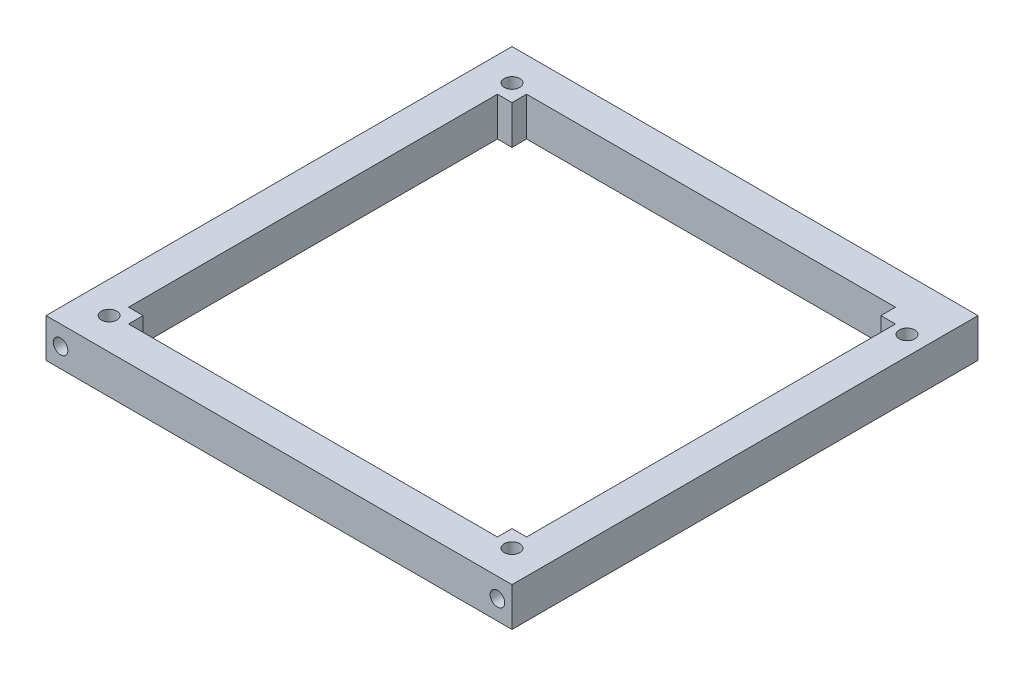
from build123d import *

# Parameters (mm, degrees)
SKETCH1_W                    = 96
SKETCH1_H                    = 96
SKETCH1_W_2                  = 80
SKETCH1_H_2                  = 80
BOSS_EXTRUDE1_DEPTH          = 8
F_3_0_3_DIAMETER_HOLE6_D     = 3
F_3_0_3_DIAMETER_HOLE6_DEPTH = 6
F_3_0_3_DIAMETER_HOLE3_D     = 3
F_3_0_3_DIAMETER_HOLE3_DEPTH = 6
SKETCH27_W                   = 82
SKETCH27_H                   = 82
CUT_EXTRUDE2_DEPTH           = 10
SKETCH35_W                   = 3
SKETCH35_H                   = 3
BOSS_EXTRUDE2_DEPTH          = 8
F_3_2_3_2_DIAMETER_HOLE1_D   = 3.2


with BuildPart() as part:
    # Sketch1 → Boss-Extrude1 (new body)
    with BuildSketch(Plane(origin=(0, 0, 0), x_dir=(1, 0, 0), z_dir=(0, 1, 0))):
        Rectangle(SKETCH1_W, SKETCH1_H)
        Rectangle(SKETCH1_W_2, SKETCH1_H_2, mode=Mode.SUBTRACT)
    extrude(amount=BOSS_EXTRUDE1_DEPTH)

    # Ø3.0 (3) Diameter Hole6
    with Locations(Plane.XY.offset(48)):
        with Locations((45, 4), (-45, 4)):
            Hole(F_3_0_3_DIAMETER_HOLE6_D / 2, depth=F_3_0_3_DIAMETER_HOLE6_DEPTH)

    # Ø3.0 (3) Diameter Hole3
    with Locations(Plane(origin=(0, 0, -48), x_dir=(-1, 0, 0), z_dir=(0, 0, -1))):
        with Locations((45, 4), (-45, 4)):
            Hole(F_3_0_3_DIAMETER_HOLE3_D / 2, depth=F_3_0_3_DIAMETER_HOLE3_DEPTH)

    # Sketch27 → Cut-Extrude2 (cut)
    with BuildSketch(Plane(origin=(0, 8, 0), x_dir=(1, 0, 0), z_dir=(0, 1, 0))):
        Rectangle(SKETCH27_W, SKETCH27_H)
    extrude(amount=-CUT_EXTRUDE2_DEPTH, mode=Mode.SUBTRACT)

    # Sketch35 → Boss-Extrude2 (add)
    with BuildSketch(Plane(origin=(0, 8, 0), x_dir=(1, 0, 0), z_dir=(0, 1, 0))):
        with Locations((-39.5, 39.5)):
            Rectangle(SKETCH35_W, SKETCH35_H)
        with Locations((39.5, 39.5)):
            Rectangle(SKETCH35_W, SKETCH35_H)
        with Locations((39.5, -39.5)):
            Rectangle(SKETCH35_W, SKETCH35_H)
        with Locations((-39.5, -39.5)):
            Rectangle(SKETCH35_W, SKETCH35_H)
    extrude(amount=-BOSS_EXTRUDE2_DEPTH)

    # Ø3.2 (3.2) Diameter Hole1 (through all)
    with Locations(Plane(origin=(0, 8, 0), x_dir=(1, 0, 0), z_dir=(0, 1, 0))):
        with Locations((44.05, 37.33), (41.5, -41.5), (-41.5, -41.5), (-41.5, 41.5)):
            Hole(F_3_2_3_2_DIAMETER_HOLE1_D / 2)


solid = part.part
